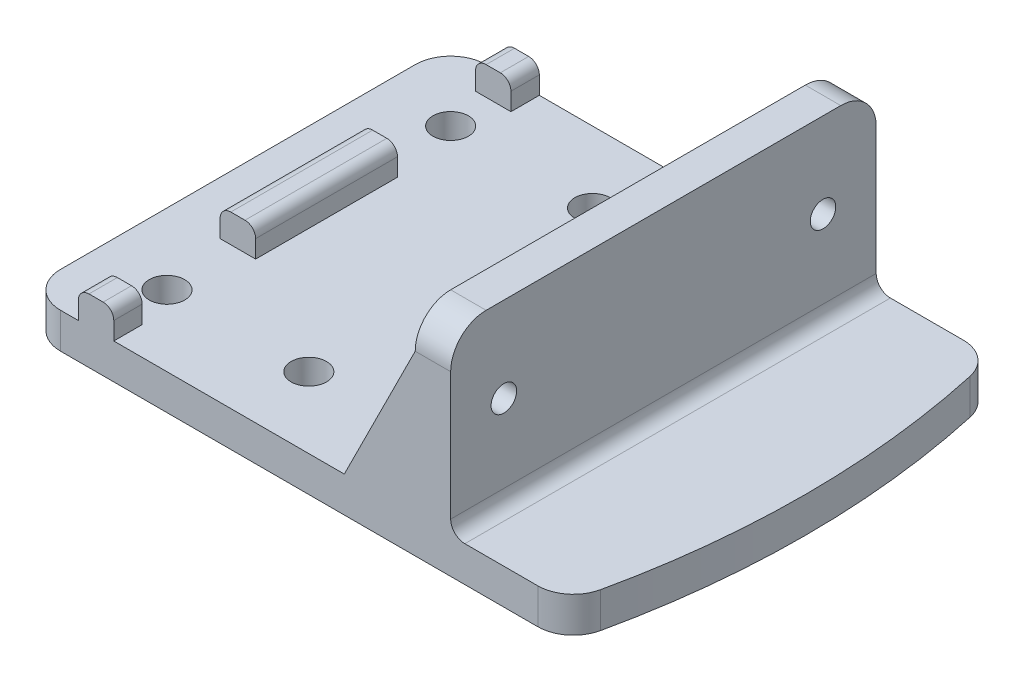
from build123d import *

# Parameters (mm, degrees)
SKETCH1_W           = 80
SKETCH1_H           = 60
BOSS_EXTRUDE1_DEPTH = 5
SKETCH2_W           = 5
SKETCH2_H           = 60
BOSS_EXTRUDE2_DEPTH = 25
SKETCH3_R           = 1.8
CUT_EXTRUDE1_DEPTH  = 30
CUT_EXTRUDE2_DEPTH  = 30
FILLET1_R           = 5
SKETCH6_R           = 2.5
CUT_EXTRUDE3_DEPTH  = 30
SKETCH8_W           = 5
SKETCH8_H           = 20
SKETCH8_H_2         = 4
BOSS_EXTRUDE3_DEPTH = 4
FILLET3_R           = 1.5
BOSS_EXTRUDE4_DEPTH = 3
FILLET4_R           = 5
FILLET5_R           = 2


with BuildPart() as part:
    # Sketch1 → Boss-Extrude1 (new body)
    with BuildSketch(Plane(origin=(0, 0, 0), x_dir=(1, 0, 0), z_dir=(0, 1, 0))):
        Rectangle(SKETCH1_W, SKETCH1_H)
    extrude(amount=BOSS_EXTRUDE1_DEPTH)

    # Sketch2 → Boss-Extrude2 (add)
    with BuildSketch(Plane(origin=(0, 5, 0), x_dir=(1, 0, 0), z_dir=(0, 1, 0))):
        with Locations((17.5, 0)):
            Rectangle(SKETCH2_W, SKETCH2_H)
    extrude(amount=BOSS_EXTRUDE2_DEPTH)

    # Sketch3 → Cut-Extrude1 (cut)
    with BuildSketch(Plane.ZY.offset(-15)):
        with Locations((-22.5, 18)):
            Circle(SKETCH3_R)
        with Locations((22.5, 18)):
            Circle(SKETCH3_R)
    extrude(amount=-CUT_EXTRUDE1_DEPTH, mode=Mode.SUBTRACT)

    # Sketch5 → Cut-Extrude2 (cut)
    with BuildSketch(Plane(origin=(0, 5, 0), x_dir=(1, 0, 0), z_dir=(0, 1, 0))):
        with BuildLine():
            Line((40, 30), (36.243947384, 30))
            ThreePointArc((36.243947384, 30), (39.057335538, 15.117108944), (40, 0))
            Line((40, 0), (40, 30))
        make_face()
        with BuildLine():
            Line((40, -30), (40, 0))
            ThreePointArc((40, 0), (39.057335538, -15.117108944), (36.243947384, -30))
            Line((36.243947384, -30), (40, -30))
        make_face()
    extrude(amount=-CUT_EXTRUDE2_DEPTH, mode=Mode.SUBTRACT)

    # Fillet1
    fillet1_edges = [part.edges().sort_by_distance(p)[0] for p in [
        (17.5, 30, 30),
        (17.5, 30, -30),
        (36.243947384, 2.5, 30),
        (36.243947384, 2.5, -30),
        (-40, 2.5, -30),
        (-40, 2.5, 30),
    ]]
    fillet(fillet1_edges, radius=FILLET1_R)

    # Sketch6 → Cut-Extrude3 (cut)
    with BuildSketch(Plane(origin=(0, 5, 0), x_dir=(1, 0, 0), z_dir=(0, 1, 0))):
        with Locations(Location((-30, 20, 0), (0, 0, 270))):
            Circle(SKETCH6_R)
        with Locations(Location((-30, -20, 0), (0, 0, 270))):
            Circle(SKETCH6_R)
        with Locations(Location((-10, 20, 0), (0, 0, 270))):
            Circle(SKETCH6_R)
        with Locations(Location((-10, -20, 0), (0, 0, 270))):
            Circle(SKETCH6_R)
    extrude(amount=-CUT_EXTRUDE3_DEPTH, mode=Mode.SUBTRACT)

    # Sketch8 → Boss-Extrude3 (add)
    with BuildSketch(Plane(origin=(0, 5, 0), x_dir=(1, 0, 0), z_dir=(0, 1, 0))):
        with Locations((-30, 0)):
            Rectangle(SKETCH8_W, SKETCH8_H)
        with Locations((-30, 28)):
            Rectangle(SKETCH8_W, SKETCH8_H_2)
        with Locations((-30, -28)):
            Rectangle(SKETCH8_W, SKETCH8_H_2)
    extrude(amount=BOSS_EXTRUDE3_DEPTH)

    # Fillet3
    fillet3_edges = [part.edges().sort_by_distance(p)[0] for p in [
        (-32.5, 9, 0),
        (-27.5, 9, 0),
        (-27.5, 9, -28),
        (-32.5, 9, -28),
        (-27.5, 9, 28),
        (-32.5, 9, 28),
    ]]
    fillet(fillet3_edges, radius=FILLET3_R)

    # Sketch9 → Boss-Extrude4 (add)
    with BuildSketch(Plane.XY.offset(30)):
        Polygon((15, 25), (5, 5), (15, 5), align=None)
    boss_extrude4 = extrude(amount=-BOSS_EXTRUDE4_DEPTH)

    # Mirror1: Boss-Extrude4 across plane
    add(boss_extrude4.mirror(Plane.XY))

    # Fillet4
    fillet4_edges = [part.edges().sort_by_distance(p)[0] for p in [
        (15, 5, 0),
    ]]
    fillet(fillet4_edges, radius=FILLET4_R)

    # Fillet5
    fillet5_edges = [part.edges().sort_by_distance(p)[0] for p in [
        (20, 5, 0),
    ]]
    fillet(fillet5_edges, radius=FILLET5_R)


solid = part.part
